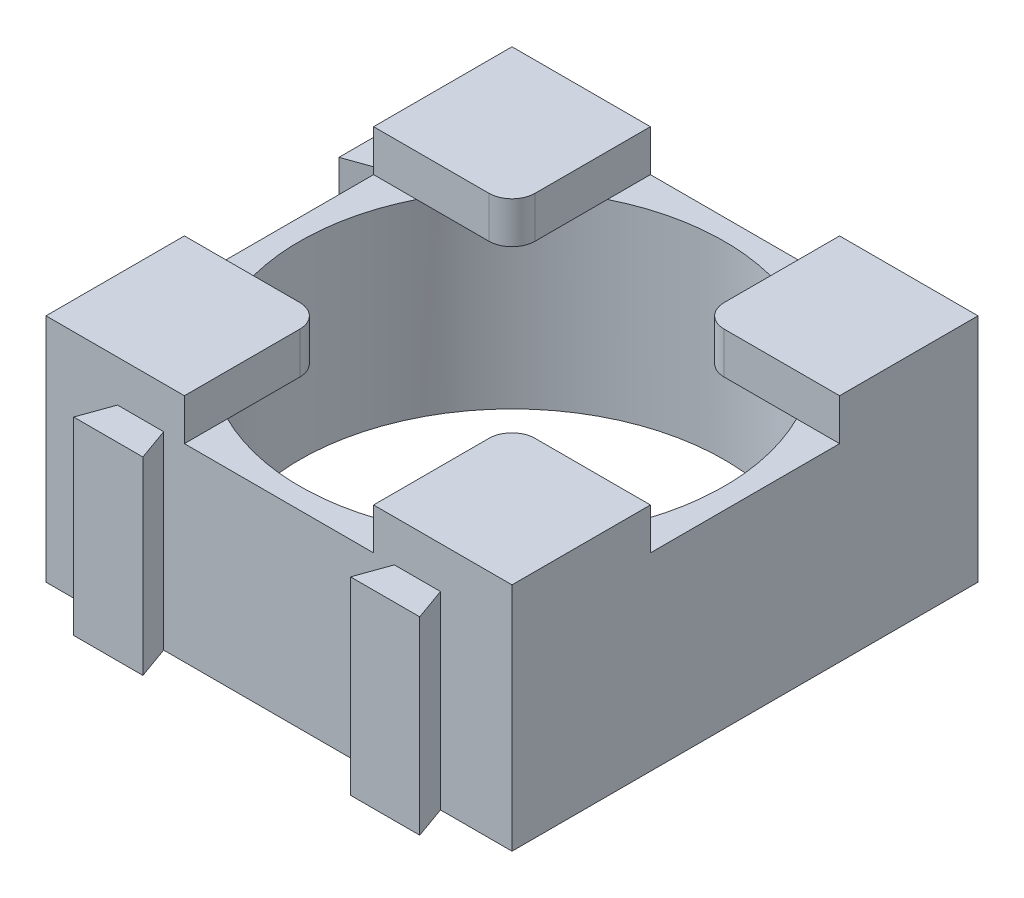
from build123d import *

# Parameters (mm, degrees)
SKETCH1_R           = 9.2
BOSS_EXTRUDE1_DEPTH = 8.2
BOSS_EXTRUDE2_DEPTH = 1.8


with BuildPart() as part:
    # Sketch1 → Boss-Extrude1 (new body)
    with BuildSketch(Plane(origin=(0, 0, 0), x_dir=(1, 0, 0), z_dir=(0, 1, 0))):
        Polygon((-10.1, 10.1), (-7, 10.1), (-7.5, 8.7), (-4.5, 8.7), (-5, 10.1), (5, 10.1), (4.5, 8.7), (7.5, 8.7), (7, 10.1), (10.1, 10.1), (10.1, 6.5), (10.1, 4.5), (10.1, -4.5), (10.1, -6.5), (10.1, -10.1), (7, -10.1), (7.5, -11.5), (4.5, -11.5), (5, -10.1), (-5, -10.1), (-4.5, -11.5), (-7.5, -11.5), (-7, -10.1), (-10.1, -10.1), (-10.1, -6.5), (-11.5, -7), (-11.5, -4), (-10.1, -4.5), (-10.1, 4.5), (-11.5, 4), (-11.5, 7), (-10.1, 6.5), align=None)
        with Locations(Location((0, 0, 0), (0, 0, 270))):
            Circle(SKETCH1_R, mode=Mode.SUBTRACT)
    extrude(amount=BOSS_EXTRUDE1_DEPTH)

    # Sketch2 → Boss-Extrude2 (add)
    with BuildSketch(Plane(origin=(0, 8.2, 0), x_dir=(1, 0, 0), z_dir=(0, 1, 0))):
        with BuildLine():
            Line((-4.1, 10.1), (-4.1, 5.1))
            ThreePointArc((-4.1, 5.1), (-4.392893219, 4.392893219), (-5.1, 4.1))
            Line((-5.1, 4.1), (-10.1, 4.1))
            Line((-10.1, 4.1), (-10.1, 10.1))
            Line((-10.1, 10.1), (-4.1, 10.1))
        make_face()
        with BuildLine():
            Line((10.1, 4.1), (10.1, 10.1))
            Line((10.1, 10.1), (4.1, 10.1))
            Line((4.1, 10.1), (4.1, 5.1))
            ThreePointArc((4.1, 5.1), (4.392893219, 4.392893219), (5.1, 4.1))
            Line((5.1, 4.1), (10.1, 4.1))
        make_face()
        with BuildLine():
            Line((4.1, -10.1), (4.1, -5.1))
            ThreePointArc((4.1, -5.1), (4.392893219, -4.392893219), (5.1, -4.1))
            Line((5.1, -4.1), (10.1, -4.1))
            Line((10.1, -4.1), (10.1, -10.1))
            Line((10.1, -10.1), (4.1, -10.1))
        make_face()
        with BuildLine():
            Line((-10.1, -4.1), (-10.1, -10.1))
            Line((-10.1, -10.1), (-4.1, -10.1))
            Line((-4.1, -10.1), (-4.1, -5.1))
            ThreePointArc((-4.1, -5.1), (-4.392893219, -4.392893219), (-5.1, -4.1))
            Line((-5.1, -4.1), (-10.1, -4.1))
        make_face()
    extrude(amount=BOSS_EXTRUDE2_DEPTH)


solid = part.part
